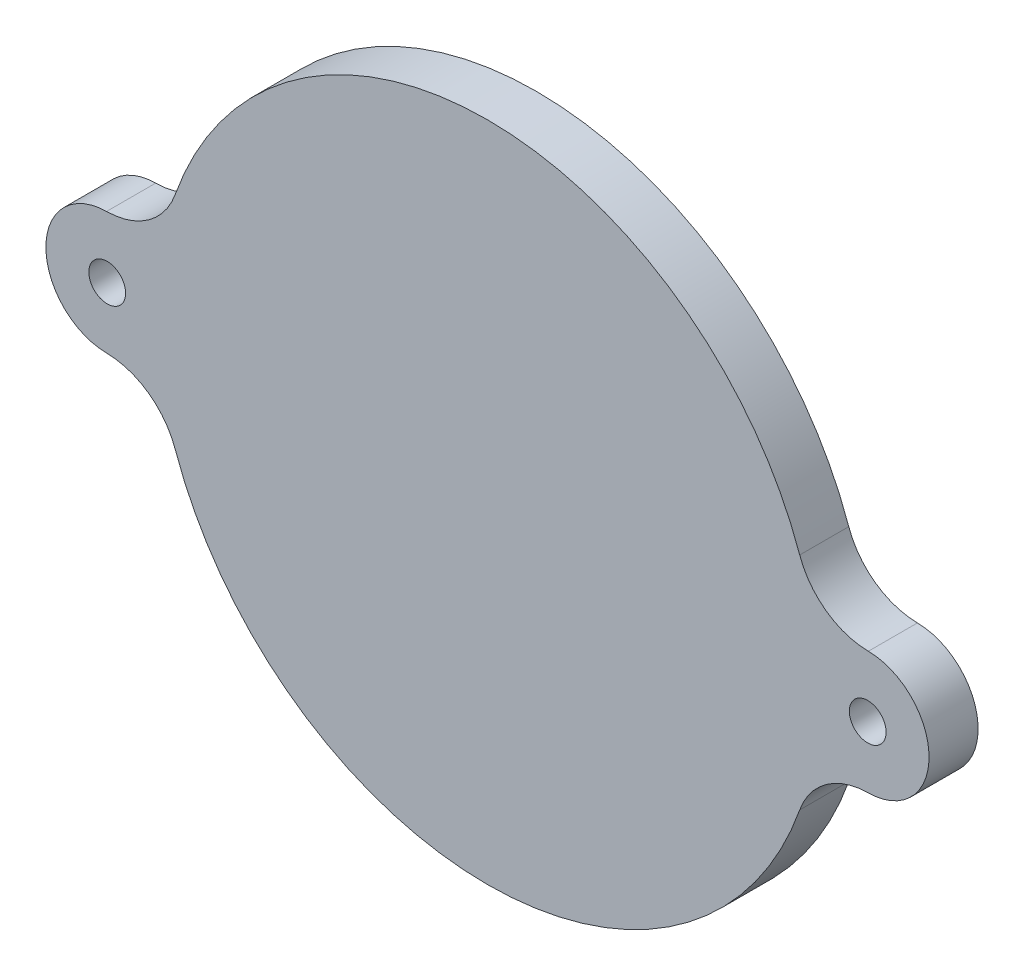
from build123d import *

# Parameters (mm, degrees)
SKETCH_1_R      = 1.5
EXTRUDE_3_DEPTH = 4
FILLET_1_R      = 6


with BuildPart() as part:
    # 草图1 → 凸台-拉伸3 (new body)
    with BuildSketch(Plane.XY):
        with BuildLine():
            ThreePointArc((-26.85483871, -2.796003912), (0, -27), (26.85483871, -2.796003912))
            ThreePointArc((26.85483871, -2.796003912), (36, 0), (26.85483871, 2.796003912))
            ThreePointArc((26.85483871, 2.796003912), (0, 27), (-26.85483871, 2.796003912))
            ThreePointArc((-26.85483871, 2.796003912), (-36, 0), (-26.85483871, -2.796003912))
        make_face()
        with Locations((31, 0)):
            Circle(SKETCH_1_R, mode=Mode.SUBTRACT)
        with Locations((-31, 0)):
            Circle(SKETCH_1_R, mode=Mode.SUBTRACT)
    extrude(amount=EXTRUDE_3_DEPTH)

    # 圆角1
    fillet_1_edges = [part.edges().sort_by_distance(p)[0] for p in [
        (-26.85483871, 2.796003912, 2),
        (26.85483871, 2.796003912, 2),
        (26.85483871, -2.796003912, 2),
        (-26.85483871, -2.796003912, 2),
    ]]
    fillet(fillet_1_edges, radius=FILLET_1_R)


solid = part.part
